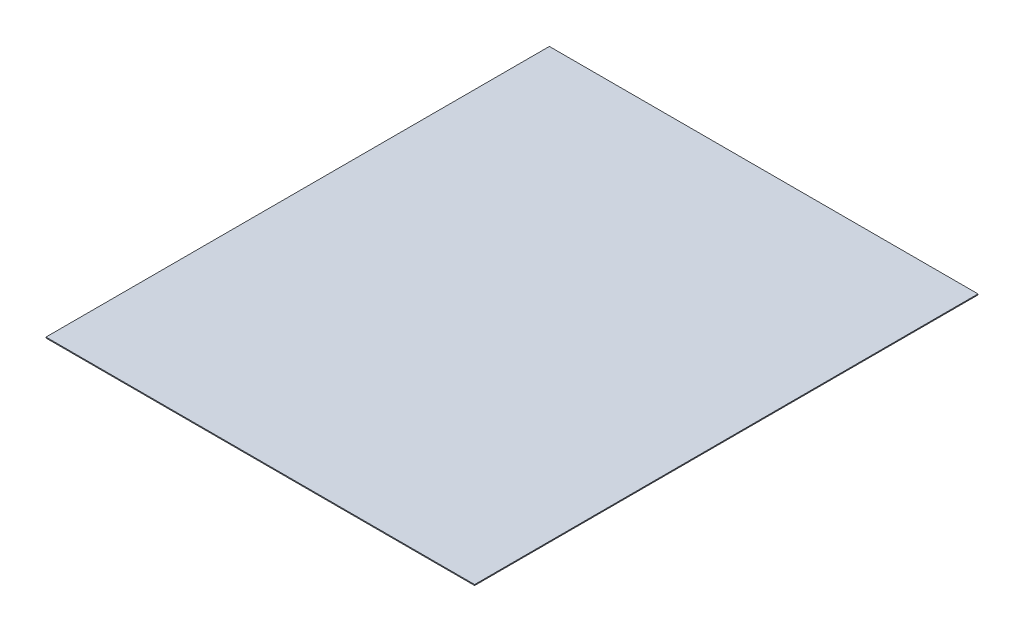
from build123d import *

# Parameters (mm, degrees)
SKETCH1_W            = 697
SKETCH1_H            = 1.5
PACK_DIS_ALT_1_DEPTH = 818.5


with BuildPart() as part:
    # Sketch1 → PACK_dis_alt_1 (new body)
    with BuildSketch(Plane.XY):
        with Locations((350, 120.75)):
            Rectangle(SKETCH1_W, SKETCH1_H)
    extrude(amount=-PACK_DIS_ALT_1_DEPTH)


solid = part.part
